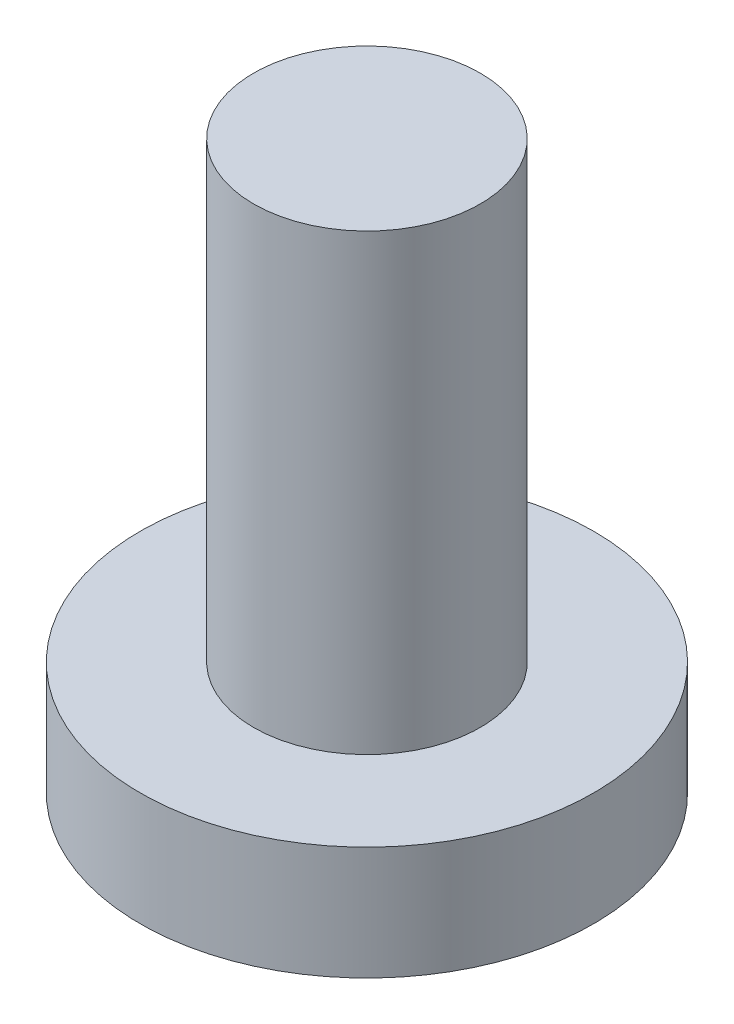
from build123d import *


with BuildPart() as part:
    # Sketch1 → Revolve1 (revolve)
    with BuildSketch(Plane.XY, mode=Mode.PRIVATE) as revolve1_sk:
        Polygon((2, 10), (0, 10), (0, 0), (4, 0), (4, 2), (2, 2), align=None)
    revolve(revolve1_sk.sketch.rotate(Axis((0, -3.367088608, 0), (0, 1, 0)), 90), axis=Axis((0, -3.367088608, 0), (0, 1, 0)))


solid = part.part
